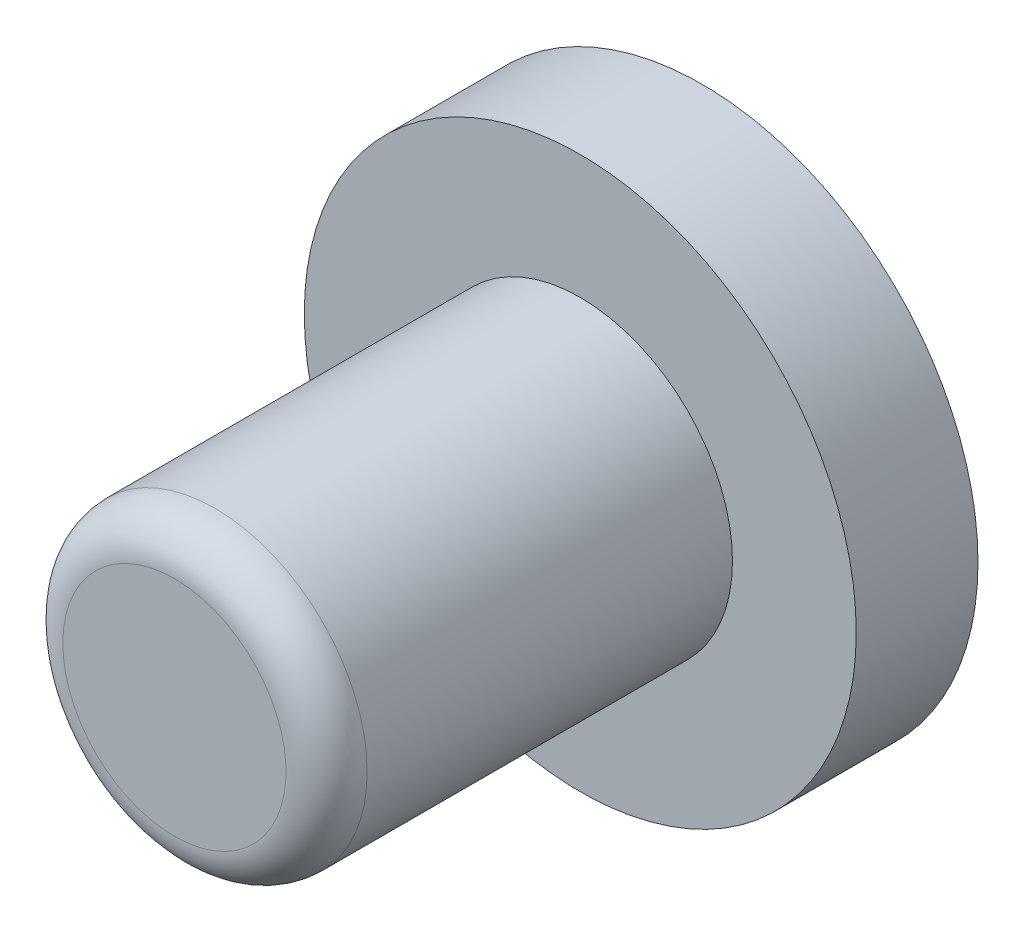
from build123d import *

# Parameters (mm, degrees)
FILLET1_R = 2.54


with BuildPart() as part:
    # Sketch1 → Revolve1 (revolve)
    with BuildSketch(Plane(origin=(0, 0, 0), x_dir=(0, 0, -1), z_dir=(1, 0, 0)), mode=Mode.PRIVATE) as revolve1_sk:
        Polygon((16.51, 0), (16.51, 17.272), (8.89, 17.272), (8.89, 9.525), (-16.51, 9.525), (-16.51, 0), align=None)
    revolve(revolve1_sk.sketch.rotate(Axis((0, 0, 51.486486486), (0, 0, -1)), 90), axis=Axis((0, 0, 51.486486486), (0, 0, -1)))

    # Fillet1
    fillet1_edges = [part.edges().sort_by_distance(p)[0] for p in [
        (-9.525, 0, 16.51),
    ]]
    fillet(fillet1_edges, radius=FILLET1_R)


solid = part.part
